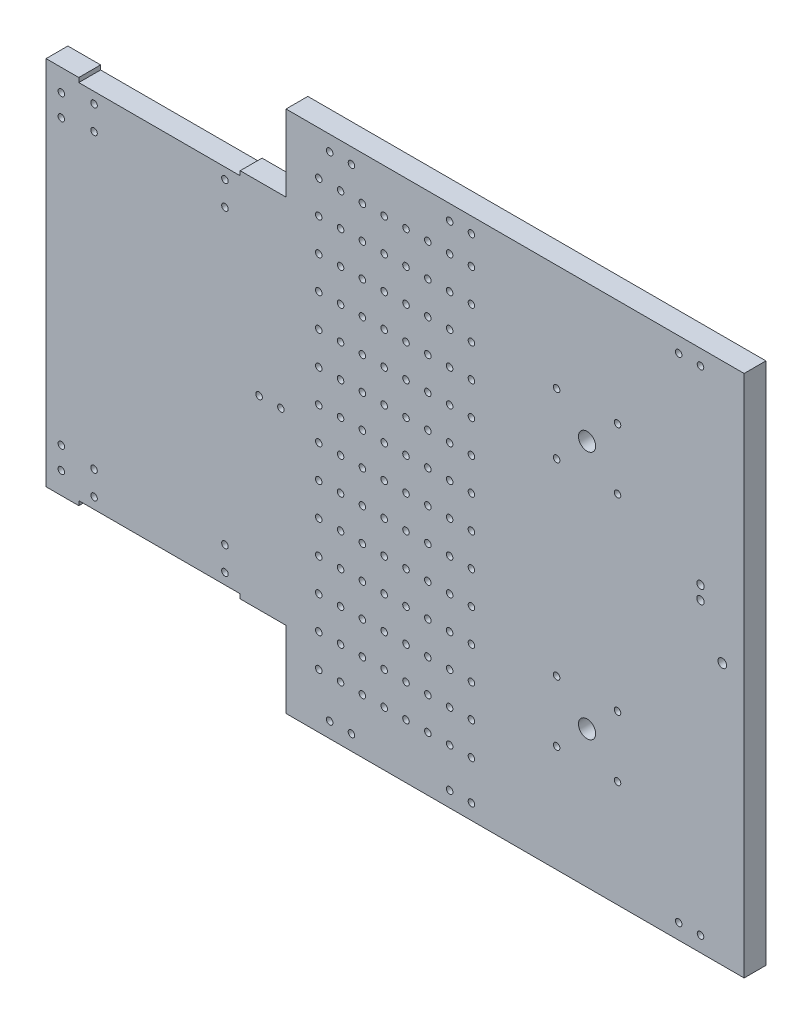
from build123d import *

# Parameters (mm, degrees)
SKETCH1_R           = 1.5
SKETCH1_R_2         = 3.94
SKETCH1_R_3         = 1.700677495
SKETCH1_R_4         = 1.7
SKETCH1_R_5         = 2
BOSS_EXTRUDE1_DEPTH = 10


with BuildPart() as part:
    # Sketch1 → Boss-Extrude1 (new body)
    with BuildSketch(Plane.XY):
        Polygon((-89.461315659, 46.582454974), (-89.461315659, 11.582454974), (-110.461315659, 11.582454974), (-110.461315659, 9.562454974), (-184.461315659, 9.562454974), (-184.461315659, 11.582454974), (-199.461315659, 11.582454974), (-199.461315659, -158.417545026), (-184.461315659, -158.417545026), (-184.461315659, -156.397545026), (-110.461315659, -156.397545026), (-110.461315659, -158.417545026), (-89.461315659, -158.417545026), (-89.461315659, -193.417545026), (120.538684341, -193.417545026), (120.538684341, 46.582454974), align=None)
        with Locations((-177.461315659, 4.582454974)):
            Circle(SKETCH1_R, mode=Mode.SUBTRACT)
        with Locations((-177.471752074, -6.417540075)):
            Circle(SKETCH1_R, mode=Mode.SUBTRACT)
        with Locations(Location((-117.472017675, 4.582454974, 0), (0, 0, 180))):
            Circle(SKETCH1_R, mode=Mode.SUBTRACT)
        with Locations(Location((-117.461581259, -6.417540075, 0), (0, 0, 180))):
            Circle(SKETCH1_R, mode=Mode.SUBTRACT)
        with Locations((-117.472017675, -151.417545026)):
            Circle(SKETCH1_R, mode=Mode.SUBTRACT)
        with Locations((-117.461581259, -140.417549977)):
            Circle(SKETCH1_R, mode=Mode.SUBTRACT)
        with Locations(Location((-177.471752074, -140.417549977, 0), (0, 0, 180))):
            Circle(SKETCH1_R, mode=Mode.SUBTRACT)
        with Locations(Location((-177.461315659, -151.417545026, 0), (0, 0, 180))):
            Circle(SKETCH1_R, mode=Mode.SUBTRACT)
        with Locations((48.538684341, -16.338988682)):
            Circle(SKETCH1_R_2, mode=Mode.SUBTRACT)
        with Locations((34.575396438, -2.385005558)):
            Circle(SKETCH1_R, mode=Mode.SUBTRACT)
        with Locations(Location((62.501972244, -2.385005558, 0), (0, 0, 180))):
            Circle(SKETCH1_R, mode=Mode.SUBTRACT)
        with Locations((62.501972244, -30.292971806)):
            Circle(SKETCH1_R, mode=Mode.SUBTRACT)
        with Locations(Location((34.575396438, -30.292971806, 0), (0, 0, 180))):
            Circle(SKETCH1_R, mode=Mode.SUBTRACT)
        with Locations((34.575396438, -116.542118246)):
            Circle(SKETCH1_R, mode=Mode.SUBTRACT)
        with Locations(Location((62.501972244, -116.542118246, 0), (0, 0, 180))):
            Circle(SKETCH1_R, mode=Mode.SUBTRACT)
        with Locations((62.501972244, -144.450084494)):
            Circle(SKETCH1_R, mode=Mode.SUBTRACT)
        with Locations(Location((34.575396438, -144.450084494, 0), (0, 0, 180))):
            Circle(SKETCH1_R, mode=Mode.SUBTRACT)
        with Locations(Location((48.538684341, -130.49610137, 0), (0, 0, 180))):
            Circle(SKETCH1_R_2, mode=Mode.SUBTRACT)
        with Locations((-74.461315659, 26.582454974)):
            Circle(SKETCH1_R, mode=Mode.SUBTRACT)
        with Locations((100.538684341, -186.417545026)):
            Circle(SKETCH1_R, mode=Mode.SUBTRACT)
        with Locations((90.538684341, -186.417545026)):
            Circle(SKETCH1_R, mode=Mode.SUBTRACT)
        with Locations(Location((-59.461315659, -186.417545026, 0), (0, 0, 180))):
            Circle(SKETCH1_R, mode=Mode.SUBTRACT)
        with Locations(Location((-69.461315659, -186.417545026, 0), (0, 0, 180))):
            Circle(SKETCH1_R, mode=Mode.SUBTRACT)
        with Locations((-69.461315659, 39.582454974)):
            Circle(SKETCH1_R, mode=Mode.SUBTRACT)
        with Locations((-59.461315659, 39.582454974)):
            Circle(SKETCH1_R, mode=Mode.SUBTRACT)
        with Locations(Location((90.538684341, 39.582454974, 0), (0, 0, 180))):
            Circle(SKETCH1_R, mode=Mode.SUBTRACT)
        with Locations(Location((100.538684341, 39.582454974, 0), (0, 0, 180))):
            Circle(SKETCH1_R, mode=Mode.SUBTRACT)
        with Locations((-64.461315659, 26.582454974)):
            Circle(SKETCH1_R, mode=Mode.SUBTRACT)
        with Locations((-54.461315659, 26.582454974)):
            Circle(SKETCH1_R, mode=Mode.SUBTRACT)
        with Locations((-44.461315659, 26.582454974)):
            Circle(SKETCH1_R, mode=Mode.SUBTRACT)
        with Locations((-34.461315659, 26.582454974)):
            Circle(SKETCH1_R, mode=Mode.SUBTRACT)
        with Locations((-24.461315659, 26.582454974)):
            Circle(SKETCH1_R, mode=Mode.SUBTRACT)
        with Locations((-14.461315659, 26.582454974)):
            Circle(SKETCH1_R, mode=Mode.SUBTRACT)
        with Locations((-4.461315659, 26.582454974)):
            Circle(SKETCH1_R, mode=Mode.SUBTRACT)
        with Locations((-64.461315659, 11.582454974)):
            Circle(SKETCH1_R, mode=Mode.SUBTRACT)
        with Locations((-54.461315659, 11.582454974)):
            Circle(SKETCH1_R, mode=Mode.SUBTRACT)
        with Locations((-44.461315659, 11.582454974)):
            Circle(SKETCH1_R, mode=Mode.SUBTRACT)
        with Locations((-34.461315659, 11.582454974)):
            Circle(SKETCH1_R, mode=Mode.SUBTRACT)
        with Locations((-24.461315659, 11.582454974)):
            Circle(SKETCH1_R, mode=Mode.SUBTRACT)
        with Locations((-14.461315659, 11.582454974)):
            Circle(SKETCH1_R, mode=Mode.SUBTRACT)
        with Locations((-4.461315659, 11.582454974)):
            Circle(SKETCH1_R, mode=Mode.SUBTRACT)
        with Locations((-64.461315659, -3.417545026)):
            Circle(SKETCH1_R, mode=Mode.SUBTRACT)
        with Locations((-54.461315659, -3.417545026)):
            Circle(SKETCH1_R, mode=Mode.SUBTRACT)
        with Locations((-44.461315659, -3.417545026)):
            Circle(SKETCH1_R, mode=Mode.SUBTRACT)
        with Locations((-34.461315659, -3.417545026)):
            Circle(SKETCH1_R, mode=Mode.SUBTRACT)
        with Locations((-24.461315659, -3.417545026)):
            Circle(SKETCH1_R, mode=Mode.SUBTRACT)
        with Locations((-14.461315659, -3.417545026)):
            Circle(SKETCH1_R, mode=Mode.SUBTRACT)
        with Locations((-4.461315659, -3.417545026)):
            Circle(SKETCH1_R, mode=Mode.SUBTRACT)
        with Locations((-64.461315659, -18.417545026)):
            Circle(SKETCH1_R, mode=Mode.SUBTRACT)
        with Locations((-54.461315659, -18.417545026)):
            Circle(SKETCH1_R, mode=Mode.SUBTRACT)
        with Locations((-44.461315659, -18.417545026)):
            Circle(SKETCH1_R, mode=Mode.SUBTRACT)
        with Locations((-34.461315659, -18.417545026)):
            Circle(SKETCH1_R, mode=Mode.SUBTRACT)
        with Locations((-24.461315659, -18.417545026)):
            Circle(SKETCH1_R, mode=Mode.SUBTRACT)
        with Locations((-14.461315659, -18.417545026)):
            Circle(SKETCH1_R, mode=Mode.SUBTRACT)
        with Locations((-4.461315659, -18.417545026)):
            Circle(SKETCH1_R, mode=Mode.SUBTRACT)
        with Locations((-64.461315659, -33.417545026)):
            Circle(SKETCH1_R, mode=Mode.SUBTRACT)
        with Locations((-54.461315659, -33.417545026)):
            Circle(SKETCH1_R, mode=Mode.SUBTRACT)
        with Locations((-44.461315659, -33.417545026)):
            Circle(SKETCH1_R, mode=Mode.SUBTRACT)
        with Locations((-34.461315659, -33.417545026)):
            Circle(SKETCH1_R, mode=Mode.SUBTRACT)
        with Locations((-24.461315659, -33.417545026)):
            Circle(SKETCH1_R, mode=Mode.SUBTRACT)
        with Locations((-14.461315659, -33.417545026)):
            Circle(SKETCH1_R, mode=Mode.SUBTRACT)
        with Locations((-4.461315659, -33.417545026)):
            Circle(SKETCH1_R, mode=Mode.SUBTRACT)
        with Locations((-64.461315659, -48.417545026)):
            Circle(SKETCH1_R, mode=Mode.SUBTRACT)
        with Locations((-54.461315659, -48.417545026)):
            Circle(SKETCH1_R, mode=Mode.SUBTRACT)
        with Locations((-44.461315659, -48.417545026)):
            Circle(SKETCH1_R, mode=Mode.SUBTRACT)
        with Locations((-34.461315659, -48.417545026)):
            Circle(SKETCH1_R, mode=Mode.SUBTRACT)
        with Locations((-24.461315659, -48.417545026)):
            Circle(SKETCH1_R, mode=Mode.SUBTRACT)
        with Locations((-14.461315659, -48.417545026)):
            Circle(SKETCH1_R, mode=Mode.SUBTRACT)
        with Locations((-4.461315659, -48.417545026)):
            Circle(SKETCH1_R, mode=Mode.SUBTRACT)
        with Locations((-64.461315659, -63.417545026)):
            Circle(SKETCH1_R, mode=Mode.SUBTRACT)
        with Locations((-54.461315659, -63.417545026)):
            Circle(SKETCH1_R, mode=Mode.SUBTRACT)
        with Locations((-44.461315659, -63.417545026)):
            Circle(SKETCH1_R, mode=Mode.SUBTRACT)
        with Locations((-34.461315659, -63.417545026)):
            Circle(SKETCH1_R, mode=Mode.SUBTRACT)
        with Locations((-24.461315659, -63.417545026)):
            Circle(SKETCH1_R, mode=Mode.SUBTRACT)
        with Locations((-14.461315659, -63.417545026)):
            Circle(SKETCH1_R, mode=Mode.SUBTRACT)
        with Locations((-4.461315659, -63.417545026)):
            Circle(SKETCH1_R, mode=Mode.SUBTRACT)
        with Locations((-64.461315659, -78.417545026)):
            Circle(SKETCH1_R, mode=Mode.SUBTRACT)
        with Locations((-54.461315659, -78.417545026)):
            Circle(SKETCH1_R, mode=Mode.SUBTRACT)
        with Locations((-44.461315659, -78.417545026)):
            Circle(SKETCH1_R, mode=Mode.SUBTRACT)
        with Locations((-34.461315659, -78.417545026)):
            Circle(SKETCH1_R, mode=Mode.SUBTRACT)
        with Locations((-24.461315659, -78.417545026)):
            Circle(SKETCH1_R, mode=Mode.SUBTRACT)
        with Locations((-14.461315659, -78.417545026)):
            Circle(SKETCH1_R, mode=Mode.SUBTRACT)
        with Locations((-4.461315659, -78.417545026)):
            Circle(SKETCH1_R, mode=Mode.SUBTRACT)
        with Locations((-64.461315659, -93.417545026)):
            Circle(SKETCH1_R, mode=Mode.SUBTRACT)
        with Locations((-54.461315659, -93.417545026)):
            Circle(SKETCH1_R, mode=Mode.SUBTRACT)
        with Locations((-44.461315659, -93.417545026)):
            Circle(SKETCH1_R, mode=Mode.SUBTRACT)
        with Locations((-34.461315659, -93.417545026)):
            Circle(SKETCH1_R, mode=Mode.SUBTRACT)
        with Locations((-24.461315659, -93.417545026)):
            Circle(SKETCH1_R, mode=Mode.SUBTRACT)
        with Locations((-14.461315659, -93.417545026)):
            Circle(SKETCH1_R, mode=Mode.SUBTRACT)
        with Locations((-4.461315659, -93.417545026)):
            Circle(SKETCH1_R, mode=Mode.SUBTRACT)
        with Locations((-64.461315659, -108.417545026)):
            Circle(SKETCH1_R, mode=Mode.SUBTRACT)
        with Locations((-54.461315659, -108.417545026)):
            Circle(SKETCH1_R, mode=Mode.SUBTRACT)
        with Locations((-44.461315659, -108.417545026)):
            Circle(SKETCH1_R, mode=Mode.SUBTRACT)
        with Locations((-34.461315659, -108.417545026)):
            Circle(SKETCH1_R, mode=Mode.SUBTRACT)
        with Locations((-24.461315659, -108.417545026)):
            Circle(SKETCH1_R, mode=Mode.SUBTRACT)
        with Locations((-14.461315659, -108.417545026)):
            Circle(SKETCH1_R, mode=Mode.SUBTRACT)
        with Locations((-4.461315659, -108.417545026)):
            Circle(SKETCH1_R, mode=Mode.SUBTRACT)
        with Locations((-64.461315659, -123.417545026)):
            Circle(SKETCH1_R, mode=Mode.SUBTRACT)
        with Locations((-54.461315659, -123.417545026)):
            Circle(SKETCH1_R, mode=Mode.SUBTRACT)
        with Locations((-44.461315659, -123.417545026)):
            Circle(SKETCH1_R, mode=Mode.SUBTRACT)
        with Locations((-34.461315659, -123.417545026)):
            Circle(SKETCH1_R, mode=Mode.SUBTRACT)
        with Locations((-24.461315659, -123.417545026)):
            Circle(SKETCH1_R, mode=Mode.SUBTRACT)
        with Locations((-14.461315659, -123.417545026)):
            Circle(SKETCH1_R, mode=Mode.SUBTRACT)
        with Locations((-4.461315659, -123.417545026)):
            Circle(SKETCH1_R, mode=Mode.SUBTRACT)
        with Locations((-64.461315659, -138.417545026)):
            Circle(SKETCH1_R, mode=Mode.SUBTRACT)
        with Locations((-54.461315659, -138.417545026)):
            Circle(SKETCH1_R, mode=Mode.SUBTRACT)
        with Locations((-44.461315659, -138.417545026)):
            Circle(SKETCH1_R, mode=Mode.SUBTRACT)
        with Locations((-34.461315659, -138.417545026)):
            Circle(SKETCH1_R, mode=Mode.SUBTRACT)
        with Locations((-24.461315659, -138.417545026)):
            Circle(SKETCH1_R, mode=Mode.SUBTRACT)
        with Locations((-14.461315659, -138.417545026)):
            Circle(SKETCH1_R, mode=Mode.SUBTRACT)
        with Locations((-4.461315659, -138.417545026)):
            Circle(SKETCH1_R, mode=Mode.SUBTRACT)
        with Locations((-64.461315659, -153.417545026)):
            Circle(SKETCH1_R, mode=Mode.SUBTRACT)
        with Locations((-54.461315659, -153.417545026)):
            Circle(SKETCH1_R, mode=Mode.SUBTRACT)
        with Locations((-44.461315659, -153.417545026)):
            Circle(SKETCH1_R, mode=Mode.SUBTRACT)
        with Locations((-34.461315659, -153.417545026)):
            Circle(SKETCH1_R, mode=Mode.SUBTRACT)
        with Locations((-24.461315659, -153.417545026)):
            Circle(SKETCH1_R, mode=Mode.SUBTRACT)
        with Locations((-14.461315659, -153.417545026)):
            Circle(SKETCH1_R, mode=Mode.SUBTRACT)
        with Locations((-4.461315659, -153.417545026)):
            Circle(SKETCH1_R, mode=Mode.SUBTRACT)
        with Locations((-74.461315659, 11.582454974)):
            Circle(SKETCH1_R, mode=Mode.SUBTRACT)
        with Locations((-74.461315659, -3.417545026)):
            Circle(SKETCH1_R, mode=Mode.SUBTRACT)
        with Locations((-74.461315659, -18.417545026)):
            Circle(SKETCH1_R, mode=Mode.SUBTRACT)
        with Locations((-74.461315659, -33.417545026)):
            Circle(SKETCH1_R, mode=Mode.SUBTRACT)
        with Locations((-74.461315659, -48.417545026)):
            Circle(SKETCH1_R, mode=Mode.SUBTRACT)
        with Locations((-74.461315659, -63.417545026)):
            Circle(SKETCH1_R, mode=Mode.SUBTRACT)
        with Locations((-74.461315659, -78.417545026)):
            Circle(SKETCH1_R, mode=Mode.SUBTRACT)
        with Locations((-74.461315659, -93.417545026)):
            Circle(SKETCH1_R, mode=Mode.SUBTRACT)
        with Locations((-74.461315659, -108.417545026)):
            Circle(SKETCH1_R, mode=Mode.SUBTRACT)
        with Locations((-74.461315659, -123.417545026)):
            Circle(SKETCH1_R, mode=Mode.SUBTRACT)
        with Locations((-74.461315659, -138.417545026)):
            Circle(SKETCH1_R, mode=Mode.SUBTRACT)
        with Locations((-74.461315659, -153.417545026)):
            Circle(SKETCH1_R, mode=Mode.SUBTRACT)
        with Locations(Location((-192.461315659, -8.417545026, 0), (0, 0, 180))):
            Circle(SKETCH1_R, mode=Mode.SUBTRACT)
        with Locations(Location((-192.461315659, 1.582454974, 0), (0, 0, 180))):
            Circle(SKETCH1_R, mode=Mode.SUBTRACT)
        with Locations((-192.461315659, -148.417545026)):
            Circle(SKETCH1_R, mode=Mode.SUBTRACT)
        with Locations((-192.461315659, -138.417545026)):
            Circle(SKETCH1_R, mode=Mode.SUBTRACT)
        with Locations(Location((-101.817874299, -73.417545026, 0), (0, 0, 180))):
            Circle(SKETCH1_R, mode=Mode.SUBTRACT)
        with Locations(Location((-91.817874299, -73.417545026, 0), (0, 0, 180))):
            Circle(SKETCH1_R, mode=Mode.SUBTRACT)
        with Locations((-4.461315659, -186.417545026)):
            Circle(SKETCH1_R, mode=Mode.SUBTRACT)
        with Locations((-14.461315659, -186.417545026)):
            Circle(SKETCH1_R, mode=Mode.SUBTRACT)
        with Locations(Location((-14.461315659, 39.582454974, 0), (0, 0, 180))):
            Circle(SKETCH1_R, mode=Mode.SUBTRACT)
        with Locations(Location((-4.461315659, 39.582454974, 0), (0, 0, 180))):
            Circle(SKETCH1_R, mode=Mode.SUBTRACT)
        with Locations((-74.461315659, -168.417545026)):
            Circle(SKETCH1_R, mode=Mode.SUBTRACT)
        with Locations((-64.461315659, -168.417545026)):
            Circle(SKETCH1_R, mode=Mode.SUBTRACT)
        with Locations((-54.461315659, -168.417545026)):
            Circle(SKETCH1_R, mode=Mode.SUBTRACT)
        with Locations((-44.461315659, -168.417545026)):
            Circle(SKETCH1_R, mode=Mode.SUBTRACT)
        with Locations((-34.461315659, -168.417545026)):
            Circle(SKETCH1_R, mode=Mode.SUBTRACT)
        with Locations((-24.461315659, -168.417545026)):
            Circle(SKETCH1_R, mode=Mode.SUBTRACT)
        with Locations((-14.461315659, -168.417545026)):
            Circle(SKETCH1_R, mode=Mode.SUBTRACT)
        with Locations((-4.461315659, -168.417545026)):
            Circle(SKETCH1_R, mode=Mode.SUBTRACT)
        with Locations((100.538684341, -53.417545026)):
            Circle(SKETCH1_R_3, mode=Mode.SUBTRACT)
        with Locations((100.538684341, -47.317545026)):
            Circle(SKETCH1_R_4, mode=Mode.SUBTRACT)
        with Locations((110.538684341, -73.417545026)):
            Circle(SKETCH1_R_5, mode=Mode.SUBTRACT)
    extrude(amount=BOSS_EXTRUDE1_DEPTH)


solid = part.part
